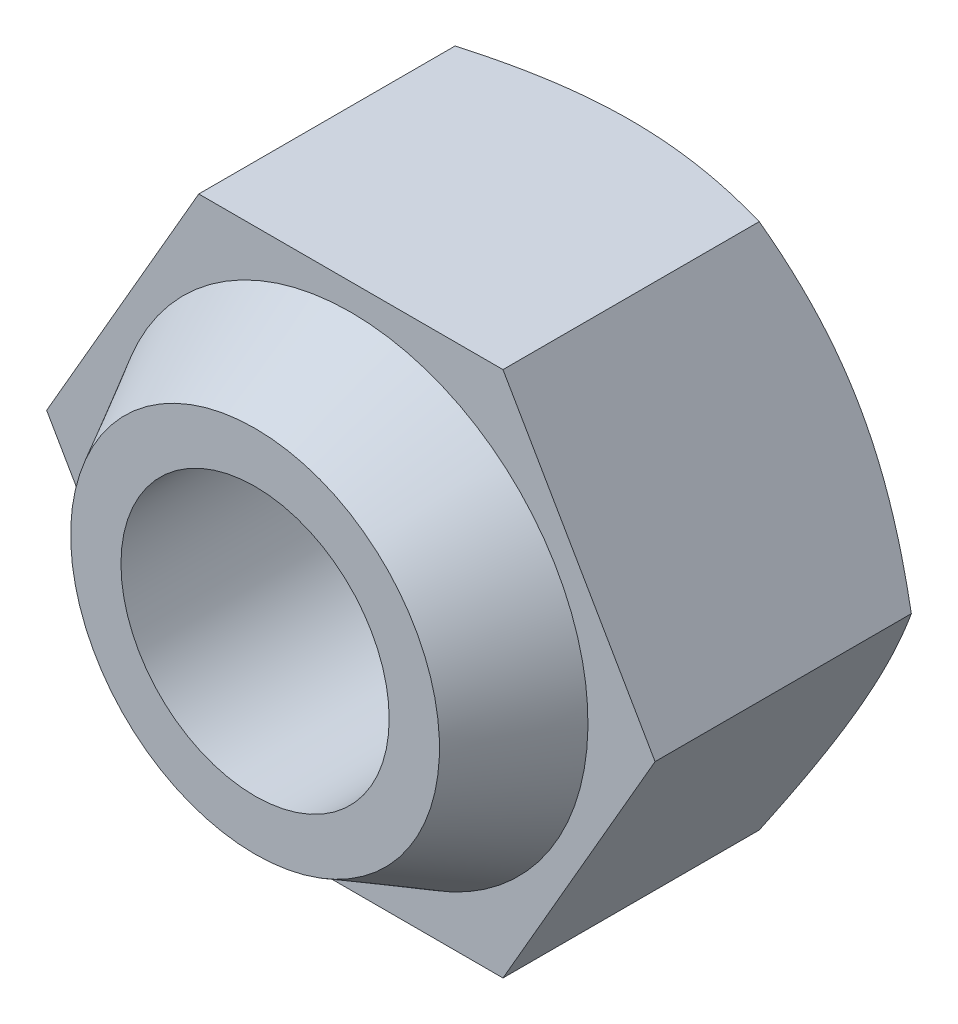
from build123d import *

# Parameters (mm, degrees)
F_0186_EXTRUDE_DEPTH        = 3
F_0186_EXTRUDE_ROTATE_ANGLE = 120
F_0185_REVOLVE_ROTATE_ANGLE = 90
F_0188_CONE_ROTATE_ANGLE    = 90
F_0191_CYLINDER_SKETCH_R    = 1.4
F_0191_CYLINDER_DEPTH       = 10


with BuildPart() as part:
    # 0186_extrude_Sketch → 0186_extrude (new body)
    with BuildSketch(Plane.XY):
        Polygon((0, 0), (3.175426481, 0), (4.763139721, 2.75), (3.175426481, 5.5), (0, 5.5), (-1.58771324, 2.75), align=None)
    extrude(amount=F_0186_EXTRUDE_DEPTH)


with BuildPart() as part_1:
    # 0186_extrude_Rotate: moved
    add(part.part.rotate(Axis((0, 0, 0), (0, 0, 1)), F_0186_EXTRUDE_ROTATE_ANGLE))


with BuildPart() as part_2:
    # 0186_extrude_Translate: moved
    add(part_1.part.moved(Location((3.175426481, 0, 0))))


with BuildPart() as body_2:
    # 0185_revolve_Sketch → 0185_revolve (revolve)
    with BuildSketch(Plane.XY, mode=Mode.PRIVATE) as f_0185_revolve_sk:
        Polygon((0, 0), (2.6125, 0), (3.675426481, 0.61368089), (3.675426481, 3), (0, 3), align=None)
    revolve(f_0185_revolve_sk.sketch.rotate(Axis((0, -100, 0), (0, 1, 0)), 90), axis=Axis((0, -100, 0), (0, 1, 0)))


with BuildPart() as body_2_1:
    # 0185_revolve_Rotate: moved
    add(body_2.part.rotate(Axis((0, 0, 0), (1, 0, 0)), F_0185_REVOLVE_ROTATE_ANGLE))


with BuildPart() as part_3:
    add(part_2.part)

    # 0187_common: intersect body 2
    add(body_2_1.part, mode=Mode.INTERSECT)


with BuildPart() as body_2_2:
    # 0188_cone_Sketch → 0188_cone (revolve)
    with BuildSketch(Plane.XY, mode=Mode.PRIVATE) as f_0188_cone_sk:
        Polygon((0, 0), (2.475, 0), (1.925, 1), (0, 1), align=None)
    revolve(f_0188_cone_sk.sketch.rotate(Axis((0, -100, 0), (0, 1, 0)), 90), axis=Axis((0, -100, 0), (0, 1, 0)))


with BuildPart() as body_2_2_1:
    # 0188_cone_Rotate: moved
    add(body_2_2.part.rotate(Axis((0, 0, 0), (1, 0, 0)), F_0188_CONE_ROTATE_ANGLE))


with BuildPart() as body_2_2_2:
    # 0188_cone_Translate: moved
    add(body_2_2_1.part.moved(Location((0, 0, 3))))


with BuildPart() as part_4:
    add(part_3.part)

    # 0190_add: union body 2 2
    add(body_2_2_2.part)


with BuildPart() as body_2_3:
    # 0191_cylinder_Sketch → 0191_cylinder (new body)
    with BuildSketch(Plane.XY):
        Circle(F_0191_CYLINDER_SKETCH_R)
    extrude(amount=F_0191_CYLINDER_DEPTH)


with BuildPart() as body_2_3_1:
    # 0191_cylinder_Translate: moved
    add(body_2_3.part.moved(Location((0, 0, -5))))


with BuildPart() as part_5:
    add(part_4.part)

    # 0192_sub: cut body 2 3
    add(body_2_3_1.part, mode=Mode.SUBTRACT)


solid = part_5.part
